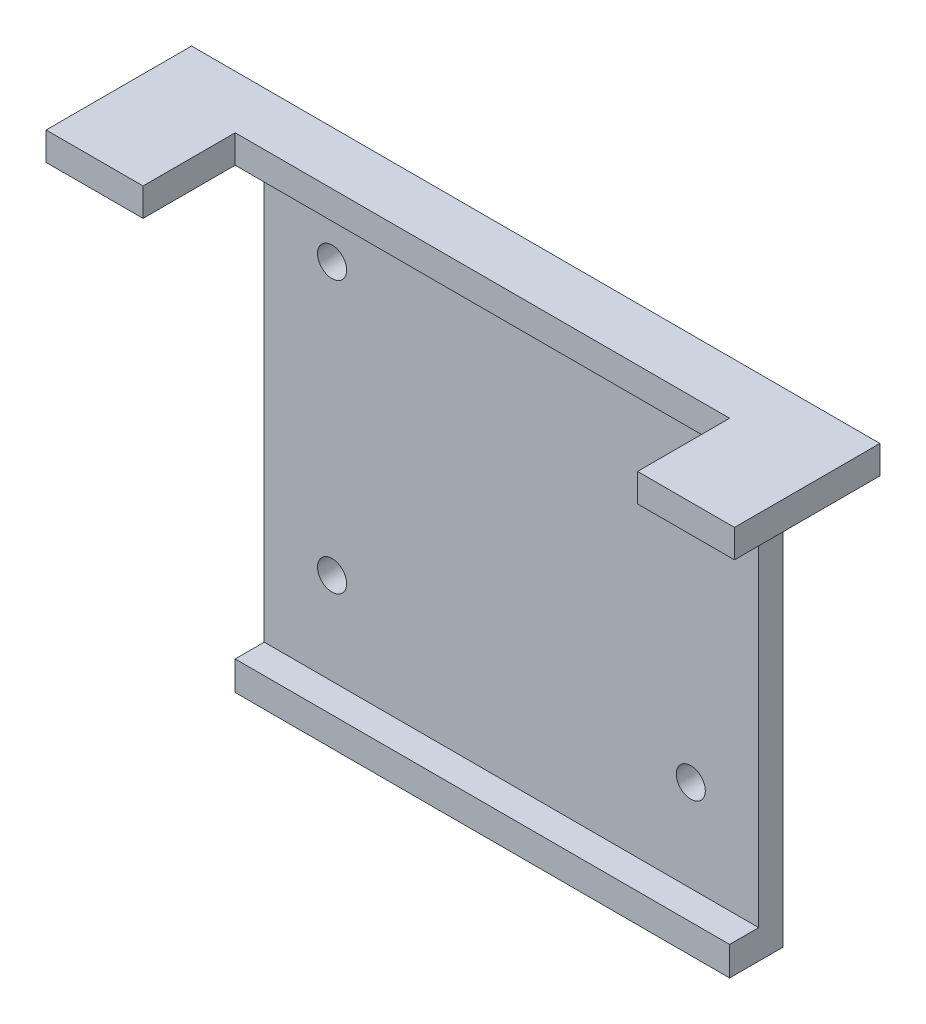
from build123d import *

# Parameters (mm, degrees)
ESQUISSE1_W             = 51
ESQUISSE1_H             = 50
BOSS_EXTRU_1_DEPTH      = 2.5
ESQUISSE2_W             = 10
ESQUISSE2_H             = 2.9
BOSS_EXTRU_2_DEPTH      = 15
ESQUISSE3_W             = 51
ESQUISSE3_H             = 2.9
ESQUISSE3_H_2           = 3
BOSS_EXTRU_3_DEPTH      = 3
ESQUISSE4_R             = 1.5
ENL_V_MAT_EXTRU_1_DEPTH = 46.937457483


with BuildPart() as part:
    # Esquisse1 → Boss.-Extru.1 (new body)
    with BuildSketch(Plane.XY):
        Rectangle(ESQUISSE1_W, ESQUISSE1_H)
    extrude(amount=BOSS_EXTRU_1_DEPTH)

    # Esquisse2 → Boss.-Extru.2 (add)
    with BuildSketch(Plane(origin=(0, 0, 0), x_dir=(-1, 0, 0), z_dir=(0, 0, -1))):
        with Locations((-30.5, 23.55)):
            Rectangle(ESQUISSE2_W, ESQUISSE2_H)
        with Locations((30.5, 23.55)):
            Rectangle(ESQUISSE2_W, ESQUISSE2_H)
    extrude(amount=-BOSS_EXTRU_2_DEPTH)

    # Esquisse3 → Boss.-Extru.3 (add)
    with BuildSketch(Plane.XY.offset(2.5)):
        with Locations((0, 23.55)):
            Rectangle(ESQUISSE3_W, ESQUISSE3_H)
        with Locations((0, -23.5)):
            Rectangle(ESQUISSE3_W, ESQUISSE3_H_2)
    extrude(amount=BOSS_EXTRU_3_DEPTH)

    # Esquisse4 → Enlèv. mat.-Extru.1 (cut, through all)
    with BuildSketch(Plane(origin=(0, 0, 0), x_dir=(-1, 0, 0), z_dir=(0, 0, -1))):
        with Locations((18.506042036, -12.531837257)):
            Circle(ESQUISSE4_R)
        with Locations((-18.493956712, -12.531832115)):
            Circle(ESQUISSE4_R)
        with Locations((-18.505955671, 15.468170274)):
            Circle(ESQUISSE4_R)
        with Locations((18.506042036, 15.468170274)):
            Circle(ESQUISSE4_R)
    extrude(amount=-ENL_V_MAT_EXTRU_1_DEPTH, mode=Mode.SUBTRACT)


solid = part.part
